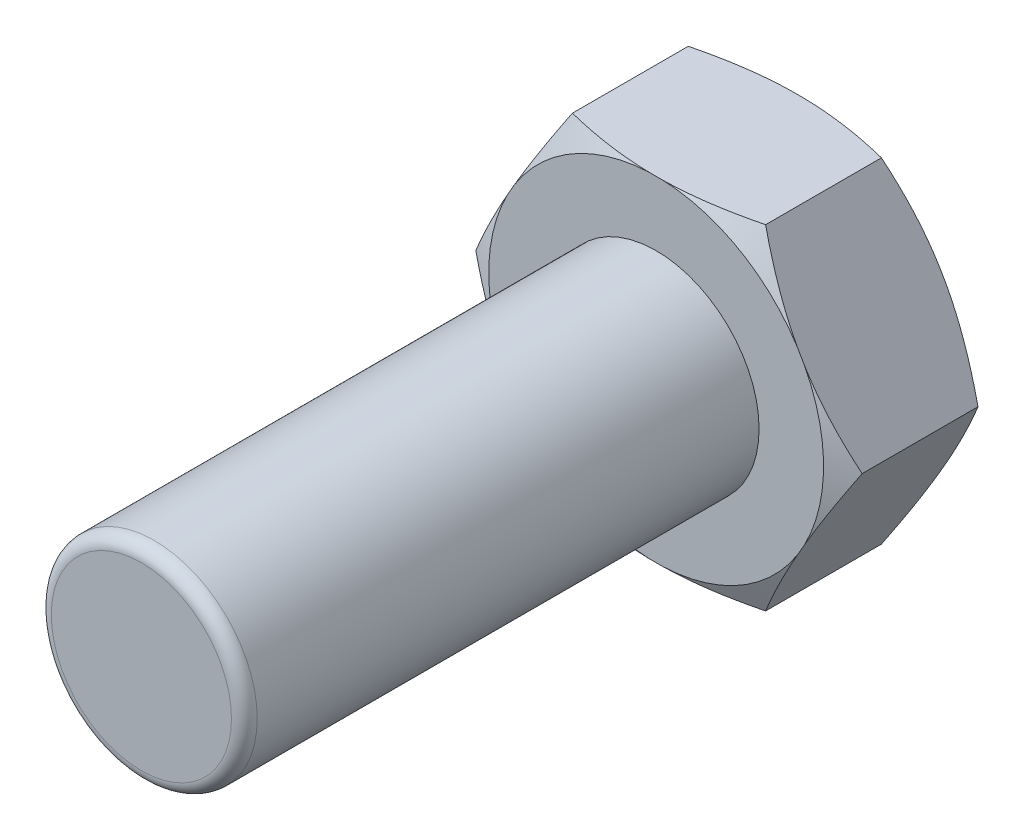
from build123d import *

# Parameters (mm, degrees)
Y_KSEKLIK_EKSTR_ZYON1_DEPTH = 5.5
IZIM2_R                     = 4
Y_KSEKLIK_EKSTR_ZYON2_DEPTH = 20
RADYUS1_R                   = 0.5


with BuildPart() as part:
    # Çizim1 → Yükseklik-Ekstrüzyon1 (new body)
    with BuildSketch(Plane.XY):
        Polygon((7.505553499, 0), (3.75277675, 6.5), (-3.75277675, 6.5), (-7.505553499, 0), (-3.75277675, -6.5), (3.75277675, -6.5), align=None)
    extrude(amount=Y_KSEKLIK_EKSTR_ZYON1_DEPTH)

    # Çizim2 → Yükseklik-Ekstrüzyon2 (add)
    with BuildSketch(Plane.XY.offset(5.5)):
        Circle(IZIM2_R)
    extrude(amount=Y_KSEKLIK_EKSTR_ZYON2_DEPTH)

    # Çizim3 → Kes-Döndür1 (revolve, cut)
    with BuildSketch(Plane(origin=(0, 0, 0), x_dir=(1, 0, 0), z_dir=(0, 1, 0))):
        Polygon((-7.505553499, 0), (-6.505553499, 0), (-7.505553499, -0.5), align=None)
        Polygon((-7.505553499, -5.5), (-7.505553499, -5), (-6.505553499, -5.5), align=None)
    revolve(axis=Axis((0, 0, 0), (0, 0, 1)), mode=Mode.SUBTRACT)

    # Radyus1
    radyus1_edges = [part.edges().sort_by_distance(p)[0] for p in [
        (-4, 0, 25.5),
    ]]
    fillet(radyus1_edges, radius=RADYUS1_R)


solid = part.part
